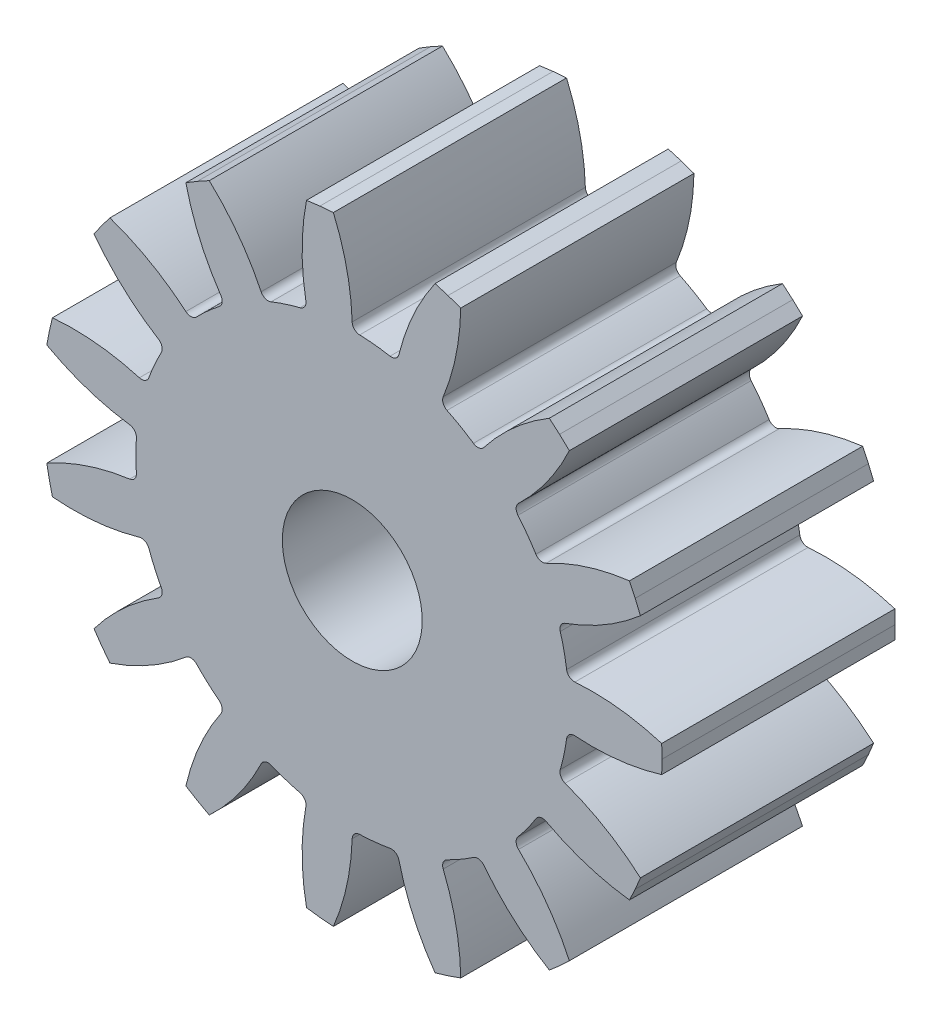
from build123d import *

# Parameters (mm, degrees)
BOSS_EXTRUDE1_DEPTH      = 10
FILLET1_R                = 0.3325
CIRPATTERN1_COUNT        = 15
FILLET1_OF_CIRPATTERN1_R = 0.3325
CUT_EXTRUDE1_REACH       = 23.263
SKETCH2_R                = 3


with BuildPart() as part:
    # Sketch1 → Boss-Extrude1 (new body)
    with BuildSketch(Plane.XY):
        with BuildLine():
            Line((13.268609193, 0.579319988), (13.28125, 0))
            Line((13.28125, 0), (13.268609193, -0.579319988))
            ThreePointArc((13.268609193, -0.579319988), (11.2692337, -0.978550661), (9.230406341, -0.9701548))
            ThreePointArc((9.230406341, -0.9701548), (9.166982411, -1.451907379), (9.078432419, -1.92968038))
            Line((9.078432419, -1.92968038), (0, 0))
            Line((0, 0), (9.078432419, 1.92968038))
            ThreePointArc((9.078432419, 1.92968038), (9.166982411, 1.451907379), (9.230406341, 0.9701548))
            ThreePointArc((9.230406341, 0.9701548), (11.2692337, 0.978550661), (13.268609193, 0.579319988))
        make_face()
    boss_extrude1 = extrude(amount=BOSS_EXTRUDE1_DEPTH)

    # Fillet1
    fillet1_edges = [part.edges().sort_by_distance(p)[0] for p in [
        (9.230406341, 0.9701548, 5),
        (9.230406341, -0.9701548, 5),
    ]]
    fillet(fillet1_edges, radius=FILLET1_R)

    # CirPattern1: Boss-Extrude1 ×15 about axis
    cirpattern1_axis = Axis((0, 0, 0), (0, 0, 1))
    for i in range(1, CIRPATTERN1_COUNT):
        add(boss_extrude1.rotate(cirpattern1_axis, i * 360 / CIRPATTERN1_COUNT))

    # Fillet1 of CirPattern1
    fillet1_of_cirpattern1_edges = [part.edges().sort_by_distance(p)[0] for p in [
        (8.037798279, 4.640625, 5),
        (8.826993292, 2.868063979, 5),
        (5.455381873, 7.508688979, 5),
        (6.897312911, 6.21036844, 5),
        (1.92968038, 9.078432419, 5),
        (3.775024469, 8.478843779, 5),
        (-1.92968038, 9.078432419, 5),
        (0, 9.28125, 5),
        (-5.455381873, 7.508688979, 5),
        (-3.775024469, 8.478843779, 5),
        (-8.037798279, 4.640625, 5),
        (-6.897312911, 6.21036844, 5),
        (-9.230406341, 0.9701548, 5),
        (-8.826993292, 2.868063979, 5),
        (-8.826993292, -2.868063979, 5),
        (-9.230406341, -0.9701548, 5),
        (-6.897312911, -6.21036844, 5),
        (-8.037798279, -4.640625, 5),
        (-3.775024469, -8.478843779, 5),
        (-5.455381873, -7.508688979, 5),
        (0, -9.28125, 5),
        (-1.92968038, -9.078432419, 5),
        (3.775024469, -8.478843779, 5),
        (1.92968038, -9.078432419, 5),
        (6.897312911, -6.21036844, 5),
        (5.455381873, -7.508688979, 5),
        (8.826993292, -2.868063979, 5),
        (8.037798279, -4.640625, 5),
    ]]
    fillet(fillet1_of_cirpattern1_edges, radius=FILLET1_OF_CIRPATTERN1_R)

    # Sketch2 → Cut-Extrude1 (cut, up to next)
    with BuildSketch(Plane(origin=(0, 0, 0), x_dir=(-1, 0, 0), z_dir=(0, 0, -1)), mode=Mode.PRIVATE) as cut_extrude1_sk1:
        Circle(SKETCH2_R)
    cut_extrude1_tool1 = extrude(cut_extrude1_sk1.sketch, amount=-CUT_EXTRUDE1_REACH, mode=Mode.PRIVATE) & part.part
    add(cut_extrude1_tool1.solids().sort_by_distance((0, 0, 0))[0], mode=Mode.SUBTRACT)


solid = part.part
